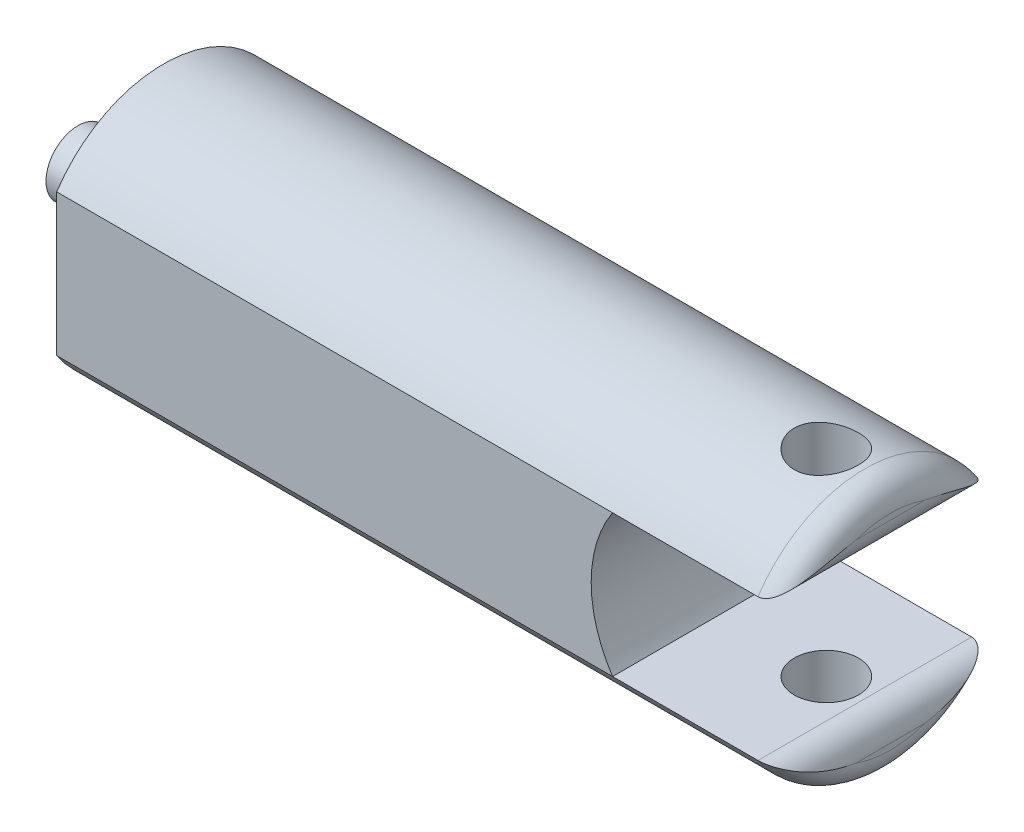
from build123d import *

# Parameters (mm, degrees)
BOSS_EXTRUDE1_DEPTH = 170
SKETCH5_R           = 7.5
BOSS_EXTRUDE2_DEPTH = 20
CUT_EXTRUDE1_DEPTH  = 180.722007556
SKETCH8_R           = 7.5
CUT_EXTRUDE2_DEPTH  = 48.5
FILLET1_R           = 6


with BuildPart() as part:
    # Sketch1 → Boss-Extrude1 (new body)
    with BuildSketch(Plane(origin=(0, 0, 0), x_dir=(0, 0, -1), z_dir=(1, 0, 0))):
        with BuildLine():
            Line((-25, 16.583123952), (-25, -16.583123952))
            ThreePointArc((-25, -16.583123952), (0, -30), (25, -16.583123952))
            Line((25, -16.583123952), (25, 16.583123952))
            ThreePointArc((25, 16.583123952), (0, 30), (-25, 16.583123952))
        make_face()
    extrude(amount=BOSS_EXTRUDE1_DEPTH)

    # Sketch5 → Boss-Extrude2 (add)
    with BuildSketch(Plane.ZY):
        with Locations(Location((0, 0, 0), (0, 0, 180))):
            Circle(SKETCH5_R)
    extrude(amount=BOSS_EXTRUDE2_DEPTH)

    # Sketch7 → Cut-Extrude1 (cut, through all)
    with BuildSketch(Plane(origin=(0, 0, -25), x_dir=(-1, 0, 0), z_dir=(0, 0, -1))):
        with BuildLine():
            Line((-180, -16.583123952), (-130, -16.583123952))
            ThreePointArc((-130, -16.583123952), (-125, 0), (-130, 16.583123952))
            Line((-130, 16.583123952), (-180, 16.583123952))
            ThreePointArc((-180, 16.583123952), (-185, 0), (-180, -16.583123952))
        make_face()
    extrude(amount=-CUT_EXTRUDE1_DEPTH, mode=Mode.SUBTRACT)

    # Sketch8 → Cut-Extrude2 (cut, symmetric)
    with BuildSketch(Plane(origin=(0, 0, 0), x_dir=(1, 0, 0), z_dir=(0, 1, 0))):
        with Locations(Location((155, 0, 0), (0, 0, 270))):
            Circle(SKETCH8_R)
    extrude(amount=CUT_EXTRUDE2_DEPTH, both=True, mode=Mode.SUBTRACT)

    # Fillet1
    fillet1_edges = [part.edges().sort_by_distance(p)[0] for p in [
        (170, 30, 0),
        (170, 16.583123952, 0),
        (170, -16.583123952, 0),
        (170, -30, 0),
    ]]
    fillet(fillet1_edges, radius=FILLET1_R)


solid = part.part
